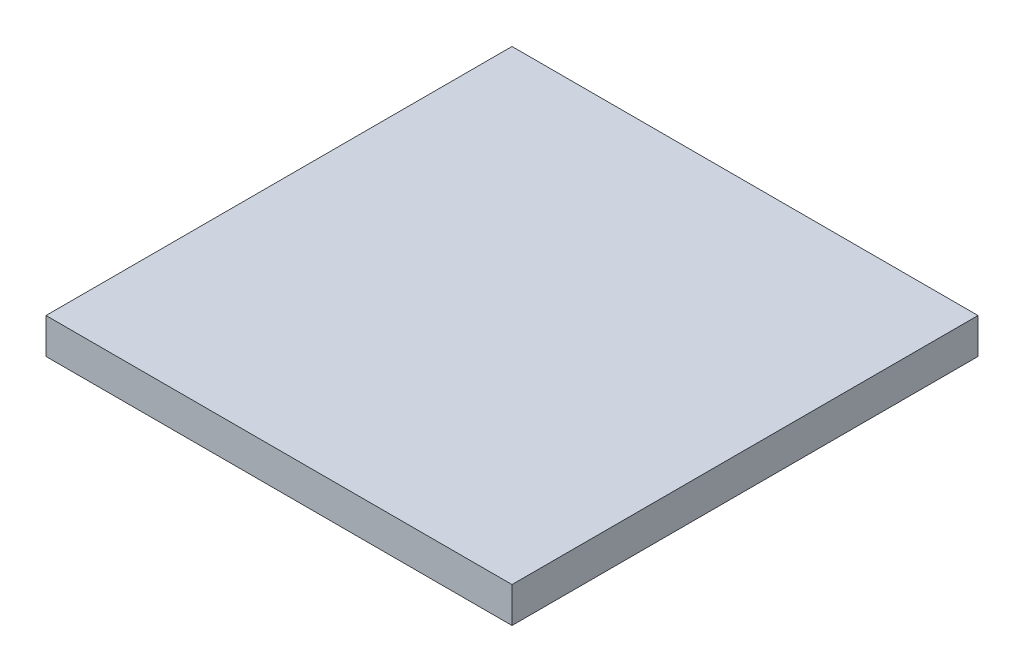
from build123d import *

# Parameters (mm, degrees)
ESQUISSE1_W        = 21
ESQUISSE1_H        = 21
BOSS_EXTRU_1_DEPTH = 1.6


with BuildPart() as part:
    # Esquisse1 → Boss.-Extru.1 (new body)
    with BuildSketch(Plane(origin=(0, 0, 0), x_dir=(1, 0, 0), z_dir=(0, 1, 0))):
        Rectangle(ESQUISSE1_W, ESQUISSE1_H)
    extrude(amount=BOSS_EXTRU_1_DEPTH)


solid = part.part
